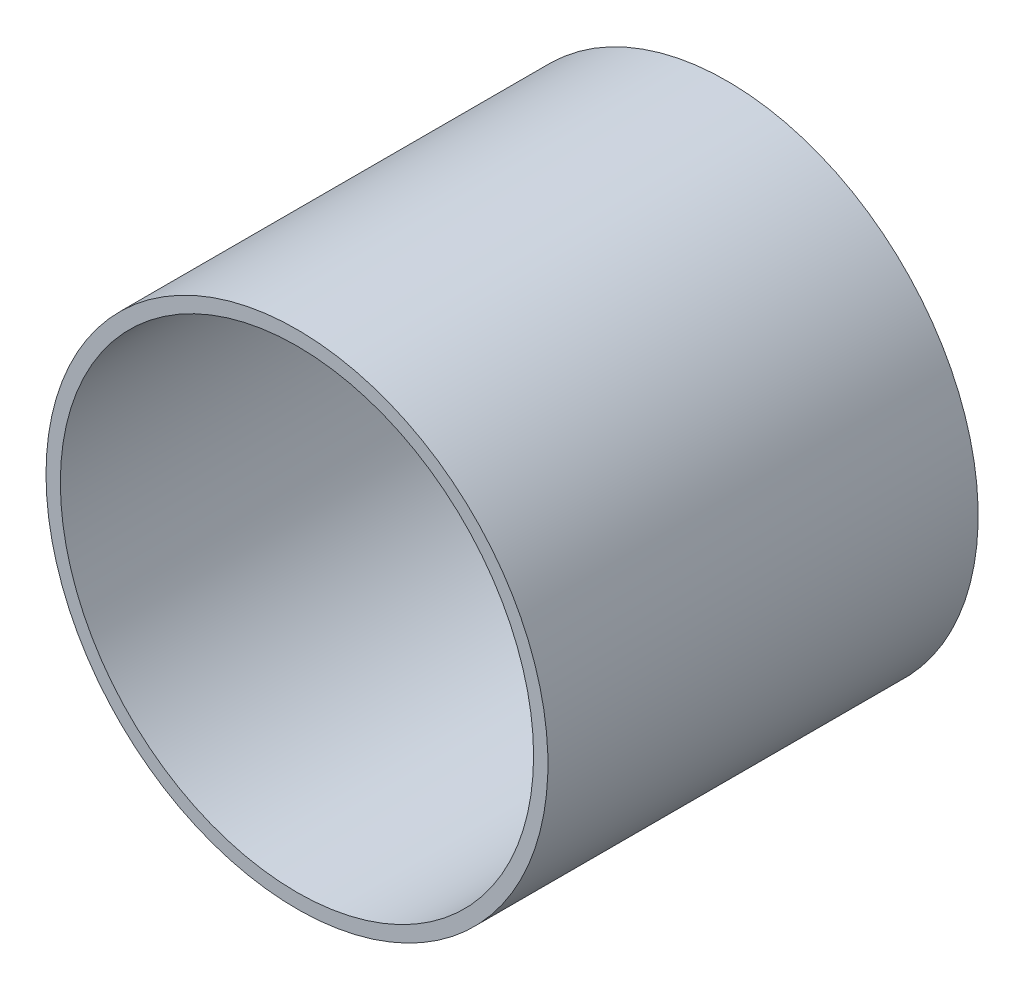
from build123d import *

# Parameters (mm, degrees)
SKETCH2_R           = 44.45
BOSS_EXTRUDE1_DEPTH = 76.2
SHELL1_T            = -2.54
SKETCH3_R           = 41.91
CUT_EXTRUDE1_DEPTH  = 76.2


with BuildPart() as part:
    # Sketch2 → Boss-Extrude1 (new body)
    with BuildSketch(Plane.XY):
        with Locations(Location((0, 0, 0), (0, 0, 180))):
            Circle(SKETCH2_R)
    extrude(amount=BOSS_EXTRUDE1_DEPTH)

    # Shell1
    shell1_openings = [part.faces().sort_by_distance(p)[0] for p in [
        (0, 0, 0),
    ]]
    offset(amount=SHELL1_T, openings=shell1_openings, kind=Kind.INTERSECTION)

    # Sketch3 → Cut-Extrude1 (cut)
    with BuildSketch(Plane(origin=(0, 0, 73.66), x_dir=(-1, 0, 0), z_dir=(0, 0, -1))):
        Circle(SKETCH3_R)
    extrude(amount=-CUT_EXTRUDE1_DEPTH, mode=Mode.SUBTRACT)


solid = part.part
